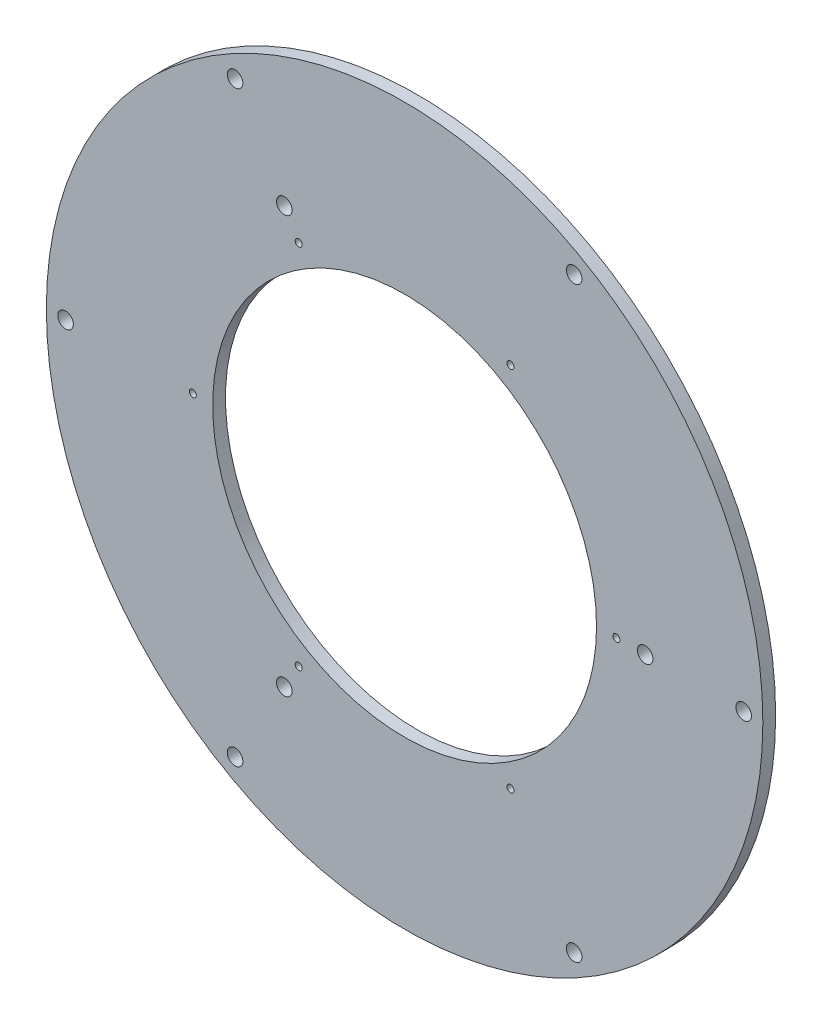
from build123d import *

# Parameters (mm, degrees)
SKETCH_2_R      = 280
SKETCH_2_R_2    = 150
SKETCH_2_R_3    = 6.1
SKETCH_2_R_4    = 2.75
EXTRUDE_1_DEPTH = 10


with BuildPart() as part:
    # Эскиз2 → Бобышка-Вытянуть1 (new body)
    with BuildSketch(Plane(origin=(0, 0, 0), x_dir=(-1, 0, 0), z_dir=(0, 0, 1))):
        with Locations(Location((0, 0, 0), (0, 0, 180))):
            Circle(SKETCH_2_R)
        with Locations(Location((0, 0, 0), (0, 0, 180))):
            Circle(SKETCH_2_R_2, mode=Mode.SUBTRACT)
        with Locations(Location((-188, 0, 0), (0, 0, 180))):
            Circle(SKETCH_2_R_3, mode=Mode.SUBTRACT)
        with Locations(Location((-165.5, 0, 0), (0, 0, 180))):
            Circle(SKETCH_2_R_4, mode=Mode.SUBTRACT)
        with Locations(Location((-265, 0, 0), (0, 0, 180))):
            Circle(SKETCH_2_R_3, mode=Mode.SUBTRACT)
        with Locations(Location((-82.75, 143.327204326, 0), (0, 0, 180))):
            Circle(SKETCH_2_R_4, mode=Mode.SUBTRACT)
        with Locations(Location((82.75, 143.327204326, 0), (0, 0, 180))):
            Circle(SKETCH_2_R_4, mode=Mode.SUBTRACT)
        with Locations(Location((165.5, 0, 0), (0, 0, 180))):
            Circle(SKETCH_2_R_4, mode=Mode.SUBTRACT)
        with Locations(Location((82.75, -143.327204326, 0), (0, 0, 180))):
            Circle(SKETCH_2_R_4, mode=Mode.SUBTRACT)
        with Locations(Location((-82.75, -143.327204326, 0), (0, 0, 180))):
            Circle(SKETCH_2_R_4, mode=Mode.SUBTRACT)
        with Locations(Location((94, 162.812775911, 0), (0, 0, 180))):
            Circle(SKETCH_2_R_3, mode=Mode.SUBTRACT)
        with Locations(Location((94, -162.812775911, 0), (0, 0, 180))):
            Circle(SKETCH_2_R_3, mode=Mode.SUBTRACT)
        with Locations(Location((-132.5, 229.496732003, 0), (0, 0, 180))):
            Circle(SKETCH_2_R_3, mode=Mode.SUBTRACT)
        with Locations(Location((132.5, 229.496732003, 0), (0, 0, 180))):
            Circle(SKETCH_2_R_3, mode=Mode.SUBTRACT)
        with Locations(Location((265, 0, 0), (0, 0, 180))):
            Circle(SKETCH_2_R_3, mode=Mode.SUBTRACT)
        with Locations(Location((132.5, -229.496732003, 0), (0, 0, 180))):
            Circle(SKETCH_2_R_3, mode=Mode.SUBTRACT)
        with Locations(Location((-132.5, -229.496732003, 0), (0, 0, 180))):
            Circle(SKETCH_2_R_3, mode=Mode.SUBTRACT)
    extrude(amount=EXTRUDE_1_DEPTH)


solid = part.part
